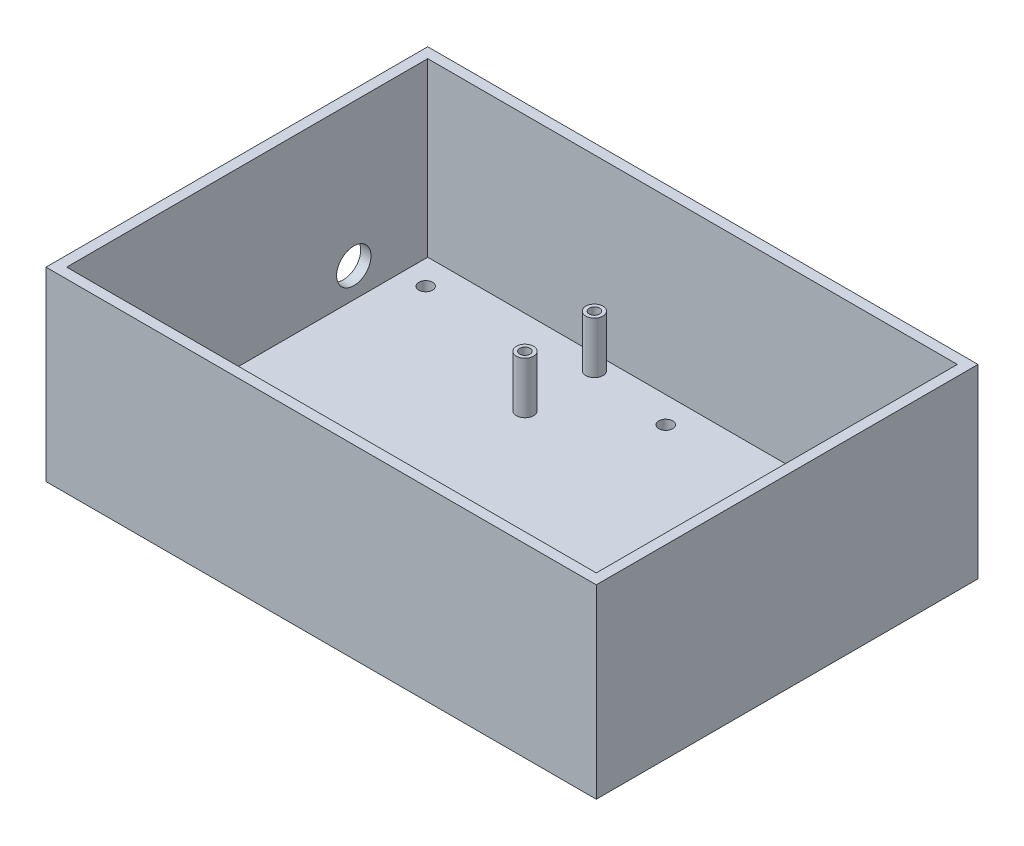
from build123d import *

# Parameters (mm, degrees)
SKETCH_1_W          = 160
SKETCH_1_H          = 111
SKETCH_1_R          = 2
SKETCH_1_R_2        = 1.5
EXTRUDE_1_DEPTH     = 4
SKETCH_2_W          = 160
SKETCH_2_H          = 111
SKETCH_2_W_2        = 154
SKETCH_2_H_2        = 105
EXTRUDE_4_DEPTH     = 50
SKETCH_3_R          = 2.5
SKETCH_3_R_2        = 1.5
EXTRUDE_5_DEPTH     = 15
SKETCH_4_R          = 5
CUT_EXTRUDE_1_DEPTH = 5


with BuildPart() as part:
    # 草图1 → 凸台-拉伸1 (new body)
    with BuildSketch(Plane(origin=(0, 0, 0), x_dir=(1, 0, 0), z_dir=(0, 1, 0))):
        with Locations((-1.924564797, 0)):
            Rectangle(SKETCH_1_W, SKETCH_1_H)
        with Locations(Location((-71.924564797, 44.9, 0), (0, 0, 270))):
            Circle(SKETCH_1_R, mode=Mode.SUBTRACT)
        with Locations(Location((-71.924564797, -44.9, 0), (0, 0, 90))):
            Circle(SKETCH_1_R, mode=Mode.SUBTRACT)
        with Locations(Location((-2.124564797, 44.9, 0), (0, 0, 270))):
            Circle(SKETCH_1_R, mode=Mode.SUBTRACT)
        with Locations(Location((-2.124564797, -44.9, 0), (0, 0, 90))):
            Circle(SKETCH_1_R, mode=Mode.SUBTRACT)
        with Locations(Location((-26.124564797, 48.16, 0), (0, 0, 270))):
            Circle(SKETCH_1_R_2, mode=Mode.SUBTRACT)
        with Locations(Location((-26.124564797, 27.96, 0), (0, 0, 270))):
            Circle(SKETCH_1_R_2, mode=Mode.SUBTRACT)
    extrude(amount=EXTRUDE_1_DEPTH)



with BuildPart() as body_2:
    # 草图2 → 凸台-拉伸4 (new body)
    with BuildSketch(Plane(origin=(0, 4, 0), x_dir=(1, 0, 0), z_dir=(0, 1, 0))):
        with Locations((-1.924564797, 0)):
            Rectangle(SKETCH_2_W, SKETCH_2_H)
        with Locations((-1.924564797, 0)):
            Rectangle(SKETCH_2_W_2, SKETCH_2_H_2, mode=Mode.SUBTRACT)
    extrude(amount=EXTRUDE_4_DEPTH)


with BuildPart() as part_1:
    add(part.part)

    add(body_2.part)  # 凸台-拉伸5 merges body 2
    # 草图3 → 凸台-拉伸5 (add)
    # profile 1 of 2: a face of its own
    with BuildSketch(Plane(origin=(0, 4, 0), x_dir=(1, 0, 0), z_dir=(0, 1, 0))):
        with Locations(Location((-26.124564797, 48.16, 0), (0, 0, 270))):
            Circle(SKETCH_3_R)
        with Locations(Location((-26.124564797, 48.16, 0), (0, 0, 270))):
            Circle(SKETCH_3_R_2, mode=Mode.SUBTRACT)
    # profile 2 of 2: a face of its own
    with BuildSketch(Plane(origin=(0, 4, 0), x_dir=(1, 0, 0), z_dir=(0, 1, 0))):
        with Locations(Location((-26.124564797, 27.96, 0), (0, 0, 270))):
            Circle(SKETCH_3_R)
        with Locations(Location((-26.124564797, 27.96, 0), (0, 0, 270))):
            Circle(SKETCH_3_R_2, mode=Mode.SUBTRACT)
    extrude(amount=EXTRUDE_5_DEPTH)

    # 草图4 → 切除-拉伸1 (cut)
    with BuildSketch(Plane.ZY.offset(81.924564797)):
        with Locations((-31, 12.58)):
            Circle(SKETCH_4_R)
    extrude(amount=-CUT_EXTRUDE_1_DEPTH, mode=Mode.SUBTRACT)


solid = part_1.part
